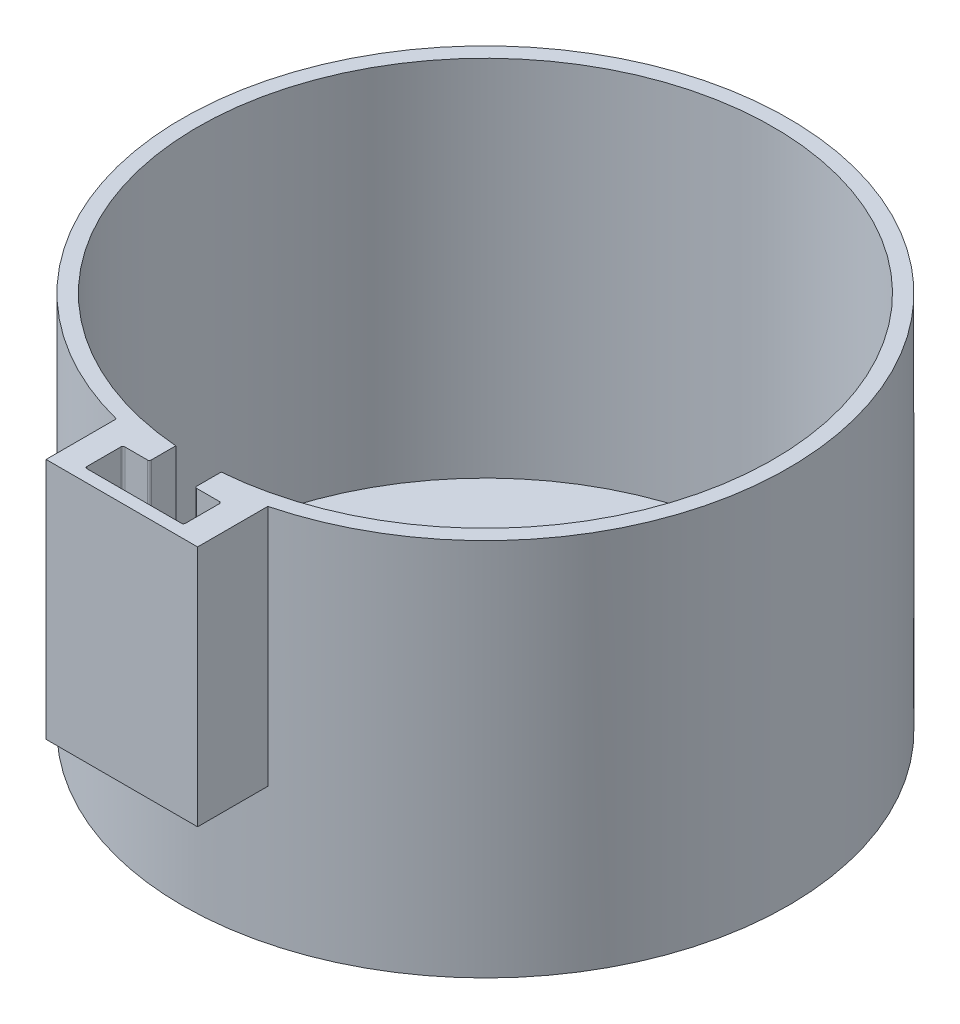
from build123d import *
from build123d.topology import SkipClean

# Parameters (mm, degrees)
SKETCH1_R           = 40
BOSS_EXTRUDE1_DEPTH = 40
SKETCH2_R           = 38
CUT_EXTRUDE1_DEPTH  = 38
CUT_EXTRUDE2_DEPTH  = 38
SKETCH4_R           = 5
CUT_EXTRUDE3_DEPTH  = 38
SKETCH6_R           = 2
BOSS_EXTRUDE2_DEPTH = 2
BOSS_EXTRUDE3_START = 10
SKETCH9_R           = 40
SKETCH9_R_2         = 38
BOSS_EXTRUDE3_DEPTH = 10
BOSS_EXTRUDE4_DEPTH = 32
CUT_EXTRUDE4_DEPTH  = 30
FILLET1_R           = 0.25
SKETCH13_R          = 3
CUT_EXTRUDE5_DEPTH  = 10


with BuildPart() as part:
    # Sketch1 → Boss-Extrude1 (new body)
    with BuildSketch(Plane(origin=(0, 0, 0), x_dir=(1, 0, 0), z_dir=(0, 1, 0))):
        with Locations(Location((0, 0, 0), (0, 0, 270))):
            Circle(SKETCH1_R)
    extrude(amount=BOSS_EXTRUDE1_DEPTH)

    # Sketch2 → Cut-Extrude1 (cut)
    with BuildSketch(Plane(origin=(0, 40, 0), x_dir=(1, 0, 0), z_dir=(0, 1, 0))):
        with Locations(Location((0, 0, 0), (0, 0, 270))):
            Circle(SKETCH2_R)
    extrude(amount=-CUT_EXTRUDE1_DEPTH, mode=Mode.SUBTRACT)

    # Sketch3 → Cut-Extrude2 (cut)
    with SkipClean():  # the faces are left unmerged after this step: merging them gives an invalid solid
        with BuildSketch(Plane(origin=(0, 2, 0), x_dir=(1, 0, 0), z_dir=(0, 1, 0))):
            with BuildLine():
                ThreePointArc((-14.076066703, -35.296803626), (0, -24.534862453), (14.076066703, -35.296803626))
                ThreePointArc((14.076066703, -35.296803626), (0, -38), (-14.076066703, -35.296803626))
            make_face()
        extrude(amount=-CUT_EXTRUDE2_DEPTH, mode=Mode.SUBTRACT)

    # Sketch4 → Cut-Extrude3 (cut)
    with SkipClean():  # the faces are left unmerged after this step: merging them gives an invalid solid
        with BuildSketch(Plane(origin=(0, 2, 0), x_dir=(1, 0, 0), z_dir=(0, 1, 0))):
            with Locations(Location((0, 0, 0), (0, 0, 270))):
                Circle(SKETCH4_R)
        extrude(amount=-CUT_EXTRUDE3_DEPTH, mode=Mode.SUBTRACT)

    # Sketch6 → Boss-Extrude2 (add)
    with SkipClean():  # the faces are left unmerged after this step: merging them gives an invalid solid
        with BuildSketch(Plane.XZ):
            with Locations(Location((-20, 0, 0), (0, 0, 90))):
                Circle(SKETCH6_R)
            with Locations(Location((20, 0, 0), (0, 0, 90))):
                Circle(SKETCH6_R)
        extrude(amount=BOSS_EXTRUDE2_DEPTH)

    # Sketch9 → Boss-Extrude3 (add)
    with SkipClean():  # the faces are left unmerged after this step: merging them gives an invalid solid
        with BuildSketch(Plane(origin=(0, 40, 0), x_dir=(1, 0, 0), z_dir=(0, 1, 0)).offset(BOSS_EXTRUDE3_START)):
            with Locations(Location((0, 0, 0), (0, 0, 270))):
                Circle(SKETCH9_R)
            with Locations(Location((0, 0, 0), (0, 0, 270))):
                Circle(SKETCH9_R_2, mode=Mode.SUBTRACT)
        extrude(amount=-BOSS_EXTRUDE3_DEPTH)

    # Sketch10 → Boss-Extrude4 (add)
    with SkipClean():  # the faces are left unmerged after this step: merging them gives an invalid solid
        with BuildSketch(Plane(origin=(0, 50, 0), x_dir=(1, 0, 0), z_dir=(0, 1, 0))):
            Polygon((0, -38), (10, -38), (10, -48), (-10, -48), (-10, -38), align=None)
        extrude(amount=-BOSS_EXTRUDE4_DEPTH)

    # Sketch11 → Cut-Extrude4 (cut)
    with SkipClean():  # the faces are left unmerged after this step: merging them gives an invalid solid
        with BuildSketch(Plane(origin=(0, 50, 0), x_dir=(1, 0, 0), z_dir=(0, 1, 0))):
            Polygon((-3, -36.864916731), (3, -36.864916731), (3, -41.364916731), (6.5, -41.364916731), (6.5, -46.364916731), (-6.5, -46.364916731), (-6.5, -41.364916731), (-3, -41.364916731), align=None)
        extrude(amount=-CUT_EXTRUDE4_DEPTH, mode=Mode.SUBTRACT)

    # Fillet1
    fillet1_edges = [part.edges().sort_by_distance(p)[0] for p in [
        (-3, 35, 41.364916731),
        (6.5, 35, 46.364916731),
        (-6.5, 35, 46.364916731),
        (-6.5, 35, 41.364916731),
        (3, 35, 41.364916731),
        (6.5, 35, 41.364916731),
    ]]
    fillet(fillet1_edges, radius=FILLET1_R)

    # Sketch13 → Cut-Extrude5 (cut)
    with BuildSketch(Plane.XZ):
        with Locations(Location((-30, 0, 0), (0, 0, 270))):
            Circle(SKETCH13_R)
        with Locations(Location((30, 0, 0), (0, 0, 270))):
            Circle(SKETCH13_R)
    extrude(amount=-CUT_EXTRUDE5_DEPTH, mode=Mode.SUBTRACT)


solid = part.part
